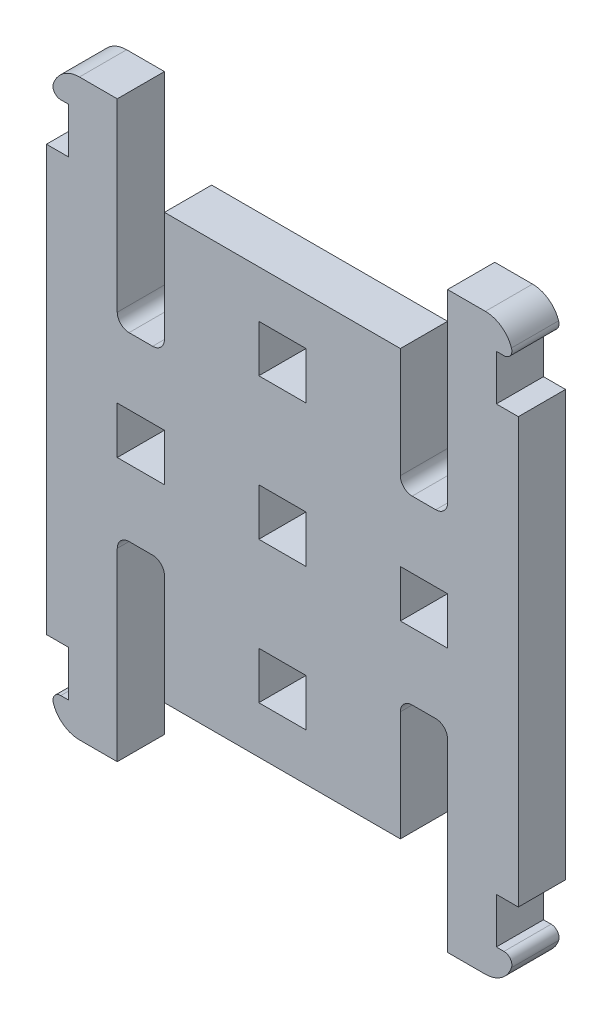
from build123d import *

# Parameters (mm, degrees)
MODEL_W                 = 3
MODEL_H                 = 3
SALIENTE_EXTRUIR1_DEPTH = 3


with BuildPart() as part:
    # Model → Saliente-Extruir1 (new body)
    with BuildSketch(Plane.XY):
        with BuildLine():
            Line((36.621026826, 298.155466529), (39.023886305, 298.155466529))
            ThreePointArc((39.023886305, 298.155466529), (40.044302886, 297.82717325), (40.681867004, 296.965466529))
            ThreePointArc((40.681867004, 296.965466529), (40.614360153, 296.513918935), (40.208158233, 296.305466529))
            Line((40.208158233, 296.305466529), (39.721026826, 296.305466529))
            Line((39.721026826, 296.305466529), (39.721026826, 293.405466529))
            Line((39.721026826, 293.405466529), (41.121026826, 293.405466529))
            Line((41.121026826, 293.405466529), (41.121026826, 266.405466529))
            Line((41.121026826, 266.405466529), (39.721026826, 266.405466529))
            Line((39.721026826, 266.405466529), (39.721026826, 263.505466529))
            Line((39.721026826, 263.505466529), (40.208158233, 263.505466529))
            ThreePointArc((40.208158233, 263.505466529), (40.614360153, 263.297014124), (40.681867004, 262.845466529))
            ThreePointArc((40.681867004, 262.845466529), (40.044302886, 261.983759808), (39.023886305, 261.655466529))
            Line((39.023886305, 261.655466529), (36.621026826, 261.655466529))
            Line((36.621026826, 261.655466529), (36.621026826, 273.405466529))
            ThreePointArc((36.621026826, 273.405466529), (36.401356911, 273.935796615), (35.871026826, 274.155466529))
            Line((35.871026826, 274.155466529), (34.371026826, 274.155466529))
            ThreePointArc((34.371026826, 274.155466529), (33.84069674, 273.935796615), (33.621026826, 273.405466529))
            Line((33.621026826, 273.405466529), (33.621026826, 266.405466529))
            Line((33.621026826, 266.405466529), (18.621026826, 266.405466529))
            Line((18.621026826, 266.405466529), (18.621026826, 273.405466529))
            ThreePointArc((18.621026826, 273.405466529), (18.401356911, 273.935796615), (17.871026826, 274.155466529))
            Line((17.871026826, 274.155466529), (16.371026826, 274.155466529))
            ThreePointArc((16.371026826, 274.155466529), (15.84069674, 273.935796615), (15.621026826, 273.405466529))
            Line((15.621026826, 273.405466529), (15.621026826, 261.655466529))
            Line((15.621026826, 261.655466529), (13.218167347, 261.655466529))
            ThreePointArc((13.218167347, 261.655466529), (12.197750765, 261.983759808), (11.560186647, 262.845466529))
            ThreePointArc((11.560186647, 262.845466529), (11.627693498, 263.297014124), (12.033895418, 263.505466529))
            Line((12.033895418, 263.505466529), (12.521026826, 263.505466529))
            Line((12.521026826, 263.505466529), (12.521026826, 266.405466529))
            Line((12.521026826, 266.405466529), (11.121026826, 266.405466529))
            Line((11.121026826, 266.405466529), (11.121026826, 293.405466529))
            Line((11.121026826, 293.405466529), (12.521026826, 293.405466529))
            Line((12.521026826, 293.405466529), (12.521026826, 296.305466529))
            Line((12.521026826, 296.305466529), (12.033895418, 296.305466529))
            ThreePointArc((12.033895418, 296.305466529), (11.627693498, 296.513918935), (11.560186647, 296.965466529))
            ThreePointArc((11.560186647, 296.965466529), (12.197750765, 297.82717325), (13.218167347, 298.155466529))
            Line((13.218167347, 298.155466529), (15.621026826, 298.155466529))
            Line((15.621026826, 298.155466529), (15.621026826, 286.405466529))
            ThreePointArc((15.621026826, 286.405466529), (15.84069674, 285.875136443), (16.371026826, 285.655466529))
            Line((16.371026826, 285.655466529), (17.871026826, 285.655466529))
            ThreePointArc((17.871026826, 285.655466529), (18.401356911, 285.875136443), (18.621026826, 286.405466529))
            Line((18.621026826, 286.405466529), (18.621026826, 293.405466529))
            Line((18.621026826, 293.405466529), (33.621026826, 293.405466529))
            Line((33.621026826, 293.405466529), (33.621026826, 286.405466529))
            ThreePointArc((33.621026826, 286.405466529), (33.84069674, 285.875136443), (34.371026826, 285.655466529))
            Line((34.371026826, 285.655466529), (35.871026826, 285.655466529))
            ThreePointArc((35.871026826, 285.655466529), (36.401356911, 285.875136443), (36.621026826, 286.405466529))
            Line((36.621026826, 286.405466529), (36.621026826, 298.155466529))
        make_face()
        with Locations((26.121026826, 288.905466529)):
            Rectangle(MODEL_W, MODEL_H, mode=Mode.SUBTRACT)
        with Locations((17.121026826, 279.905466529)):
            Rectangle(MODEL_W, MODEL_H, mode=Mode.SUBTRACT)
        with Locations((26.121026826, 279.905466529)):
            Rectangle(MODEL_W, MODEL_H, mode=Mode.SUBTRACT)
        with Locations((26.121026826, 270.905466529)):
            Rectangle(MODEL_W, MODEL_H, mode=Mode.SUBTRACT)
        with Locations((35.121026826, 279.905466529)):
            Rectangle(MODEL_W, MODEL_H, mode=Mode.SUBTRACT)
    extrude(amount=SALIENTE_EXTRUIR1_DEPTH)


solid = part.part
